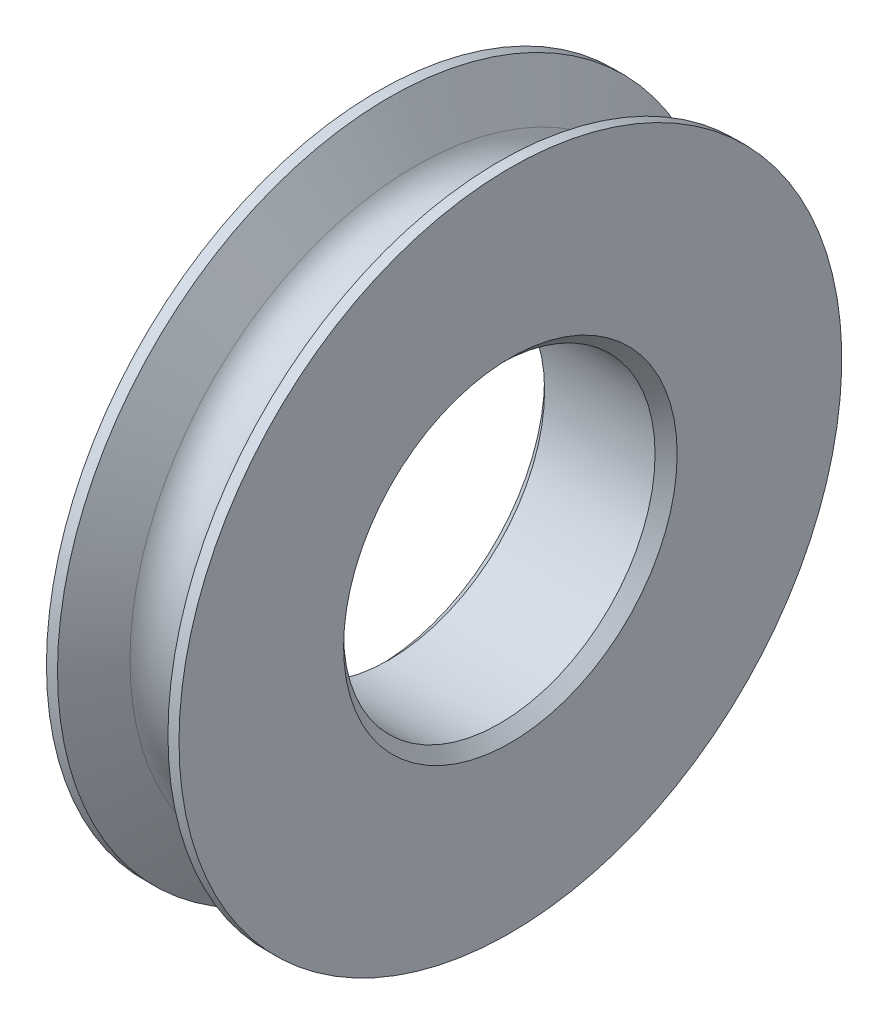
from build123d import *

# Parameters (mm, degrees)
CHAMFER_1_SIZE = 0.5


with BuildPart() as part:
    # 草图1 → 旋转1 (revolve)
    with BuildSketch(Plane.XY, mode=Mode.PRIVATE) as revolve_1_sk:
        with BuildLine():
            Line((-3, 7.05), (3, 7.05))
            Line((3, 7.05), (3, 15))
            Line((3, 15), (2.5, 15))
            Line((2.5, 15), (1.299038106, 12.919872981))
            ThreePointArc((1.299038106, 12.919872981), (0, 12.169872981), (-1.299038106, 12.919872981))
            Line((-1.299038106, 12.919872981), (-2.5, 15))
            Line((-2.5, 15), (-3, 15))
            Line((-3, 15), (-3, 7.05))
        make_face()
    revolve(revolve_1_sk.sketch.rotate(Axis((-10.233108396, 0, 0), (1, 0, 0)), 90), axis=Axis((-10.233108396, 0, 0), (1, 0, 0)))

    # 倒角1
    chamfer_1_edges = [part.edges().sort_by_distance(p)[0] for p in [
        (3, 0, -7.05),
        (-3, 0, -7.05),
    ]]
    chamfer(chamfer_1_edges, length=CHAMFER_1_SIZE)


solid = part.part
